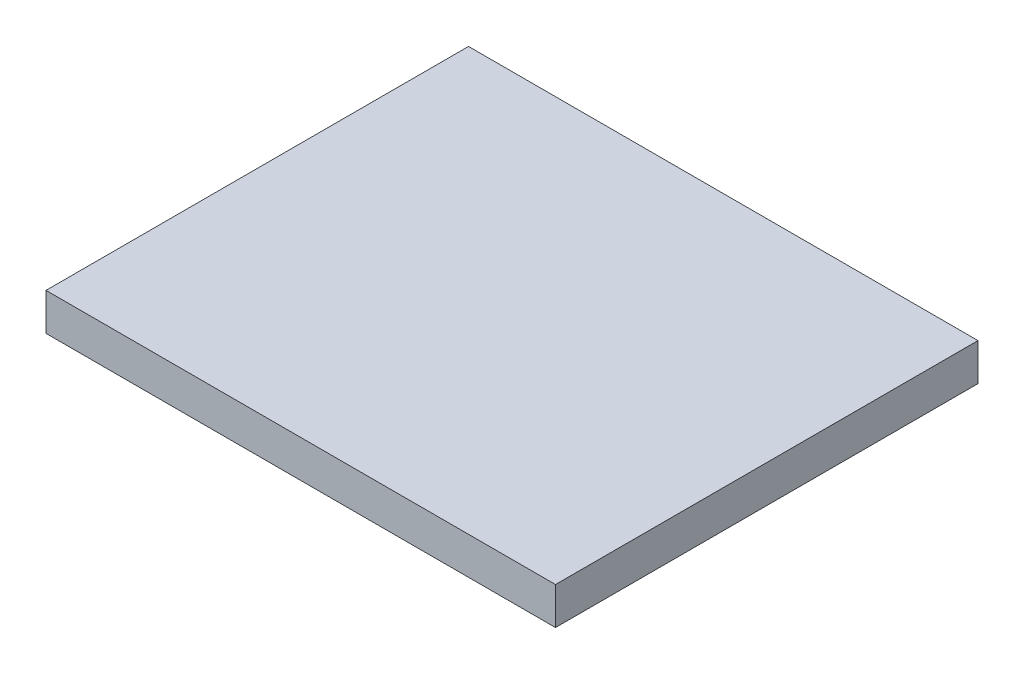
from build123d import *

# Parameters (mm, degrees)
SKETCH1_W           = 41
SKETCH1_H           = 34
BOSS_EXTRUDE1_DEPTH = 3


with BuildPart() as part:
    # Sketch1 → Boss-Extrude1 (new body)
    with BuildSketch(Plane(origin=(0, 0, 0), x_dir=(1, 0, 0), z_dir=(0, 1, 0))):
        Rectangle(SKETCH1_W, SKETCH1_H)
    extrude(amount=BOSS_EXTRUDE1_DEPTH)


solid = part.part
